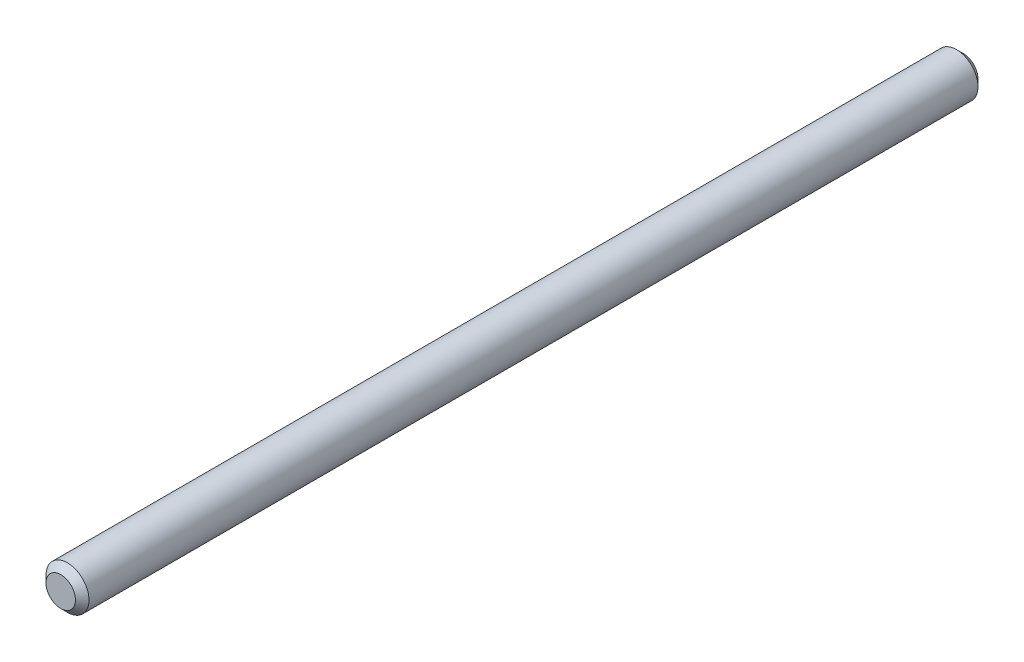
from build123d import *

# Parameters (mm, degrees)
CROQUIS1_R              = 4.7625
SALIENTE_EXTRUIR1_DEPTH = 100
CHAFL_N1_SIZE           = 1.5


with BuildPart() as part:
    # Croquis1 → Saliente-Extruir1 (new, symmetric)
    with BuildSketch(Plane.XY):
        Circle(CROQUIS1_R)
    extrude(amount=SALIENTE_EXTRUIR1_DEPTH, both=True)

    # Chaflán1
    chafl_n1_edges = [part.edges().sort_by_distance(p)[0] for p in [
        (-4.7625, 0, -100),
        (-4.7625, 0, 100),
    ]]
    chamfer(chafl_n1_edges, length=CHAFL_N1_SIZE)


solid = part.part
